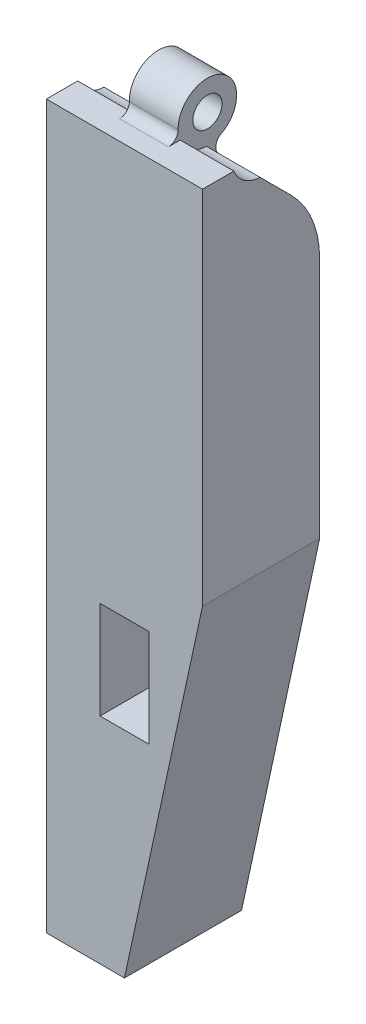
from build123d import *

# Parameters (mm, degrees)
BOSS_EXTRUDE1_DEPTH     = 12
CUT_EXTRUDE1_DEPTH      = 50.992671716
CUT_EXTRUDE1_DEPTH_BACK = 50.992671716
CUT_EXTRUDE2_DEPTH      = 50.992671716
CUT_EXTRUDE2_DEPTH_BACK = 50.992671716
SKETCH4_R               = 3
SKETCH4_R_2             = 1.5
SKETCH5_R               = 3
SKETCH5_R_2             = 1.5
BOSS_EXTRUDE2_DEPTH     = 2.5
FILLET1_R               = 1
FILLET2_R               = 10
SKETCH6_W               = 5
SKETCH6_H               = 10
CUT_EXTRUDE3_DEPTH      = 5
SKETCH7_W               = 5
SKETCH7_H               = 2.5
CUT_EXTRUDE4_DEPTH      = 10
SKETCH8_W               = 5
SKETCH8_H               = 10
CUT_EXTRUDE5_DEPTH      = 52.877425006


with BuildPart() as part:
    # Sketch1 → Boss-Extrude1 (new body)
    with BuildSketch(Plane.XY):
        Polygon((0, 26.132816823), (0, -47.867183177), (8, -47.867183177), (16, -10.867183177), (16, 26.132816823), align=None)
    extrude(amount=BOSS_EXTRUDE1_DEPTH)

    # Sketch3 → Cut-Extrude1 (cut, two sides: drawn at the far end of the back side and taken through both)
    with BuildSketch(Plane(origin=(8, 0, 0), x_dir=(0, 0, -1), z_dir=(1, 0, 0)).offset(-CUT_EXTRUDE1_DEPTH_BACK)):
        Polygon((-8, 26.132816823), (0, 26.132816823), (0, 18.132816823), align=None)
    extrude(amount=CUT_EXTRUDE1_DEPTH + CUT_EXTRUDE1_DEPTH_BACK, mode=Mode.SUBTRACT)

    # Sketch4 → Cut-Extrude2 (cut, two sides: drawn at the far end of the back side and taken through both)
    with BuildSketch(Plane(origin=(8, 0, 0), x_dir=(0, 0, -1), z_dir=(1, 0, 0)).offset(-CUT_EXTRUDE2_DEPTH_BACK)):
        with Locations((-6, 27.232816823)):
            Circle(SKETCH4_R)
        with Locations((-6, 27.232816823)):
            Circle(SKETCH4_R_2, mode=Mode.SUBTRACT)
    extrude(amount=CUT_EXTRUDE2_DEPTH + CUT_EXTRUDE2_DEPTH_BACK, mode=Mode.SUBTRACT)

    # Sketch5 → Boss-Extrude2 (add, symmetric)
    with BuildSketch(Plane(origin=(8, 0, 0), x_dir=(0, 0, -1), z_dir=(1, 0, 0))):
        with Locations((-6, 27.232816823)):
            Circle(SKETCH5_R)
        with Locations((-6, 27.232816823)):
            Circle(SKETCH5_R_2, mode=Mode.SUBTRACT)
    extrude(amount=BOSS_EXTRUDE2_DEPTH, both=True)

    # Fillet1
    fillet1_edges = [part.edges().sort_by_distance(p)[0] for p in [
        (8, 24.234541988, 6.101725164),
        (8, 26.132816823, 8.791057147),
    ]]
    fillet(fillet1_edges, radius=FILLET1_R)

    # Fillet2
    fillet2_edges = [part.edges().sort_by_distance(p)[0] for p in [
        (8, 18.132816823, 0),
    ]]
    fillet(fillet2_edges, radius=FILLET2_R)

    # Sketch6 → Cut-Extrude3 (cut)
    with BuildSketch(Plane(origin=(0, 0, 0), x_dir=(-1, 0, 0), z_dir=(0, 0, -1))):
        with Locations((-8, -0.867183177)):
            Rectangle(SKETCH6_W, SKETCH6_H)
        with Locations((-8, -20.867183177)):
            Rectangle(SKETCH6_W, SKETCH6_H)
    extrude(amount=-CUT_EXTRUDE3_DEPTH, mode=Mode.SUBTRACT)

    # Sketch7 → Cut-Extrude4 (cut)
    with BuildSketch(Plane.XZ.offset(15.867183177)):
        with Locations((8, 3.75)):
            Rectangle(SKETCH7_W, SKETCH7_H)
    extrude(amount=-CUT_EXTRUDE4_DEPTH, mode=Mode.SUBTRACT)

    # Sketch8 → Cut-Extrude5 (cut, through all)
    with BuildSketch(Plane(origin=(0, 0, 0), x_dir=(-1, 0, 0), z_dir=(0, 0, -1))):
        with Locations((-8, -20.867183177)):
            Rectangle(SKETCH8_W, SKETCH8_H)
    extrude(amount=-CUT_EXTRUDE5_DEPTH, mode=Mode.SUBTRACT)


solid = part.part
